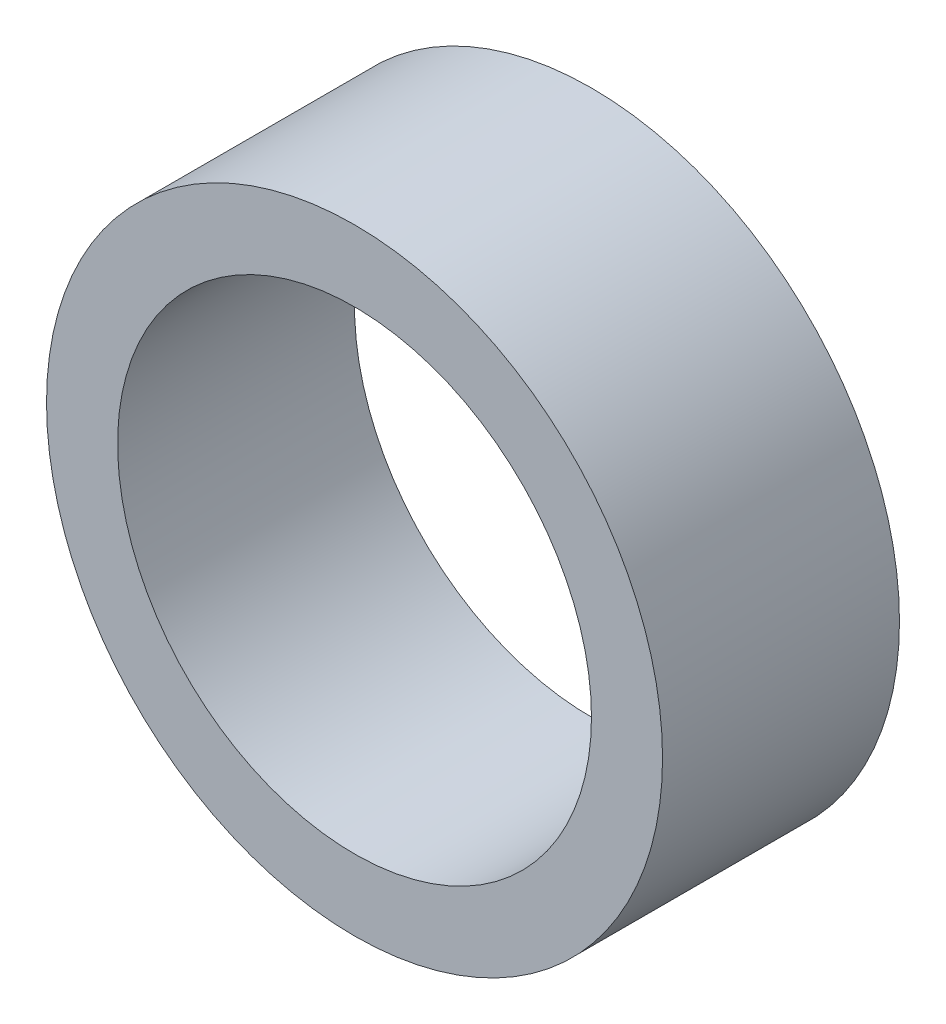
from build123d import *

# Parameters (mm, degrees)
SKETCH_1_R      = 6.5
SKETCH_1_R_2    = 5
EXTRUDE_1_DEPTH = 5


with BuildPart() as part:
    # 草图1 → 凸台-拉伸1 (new body)
    with BuildSketch(Plane.XY):
        Circle(SKETCH_1_R)
        Circle(SKETCH_1_R_2, mode=Mode.SUBTRACT)
    extrude(amount=EXTRUDE_1_DEPTH)


solid = part.part
